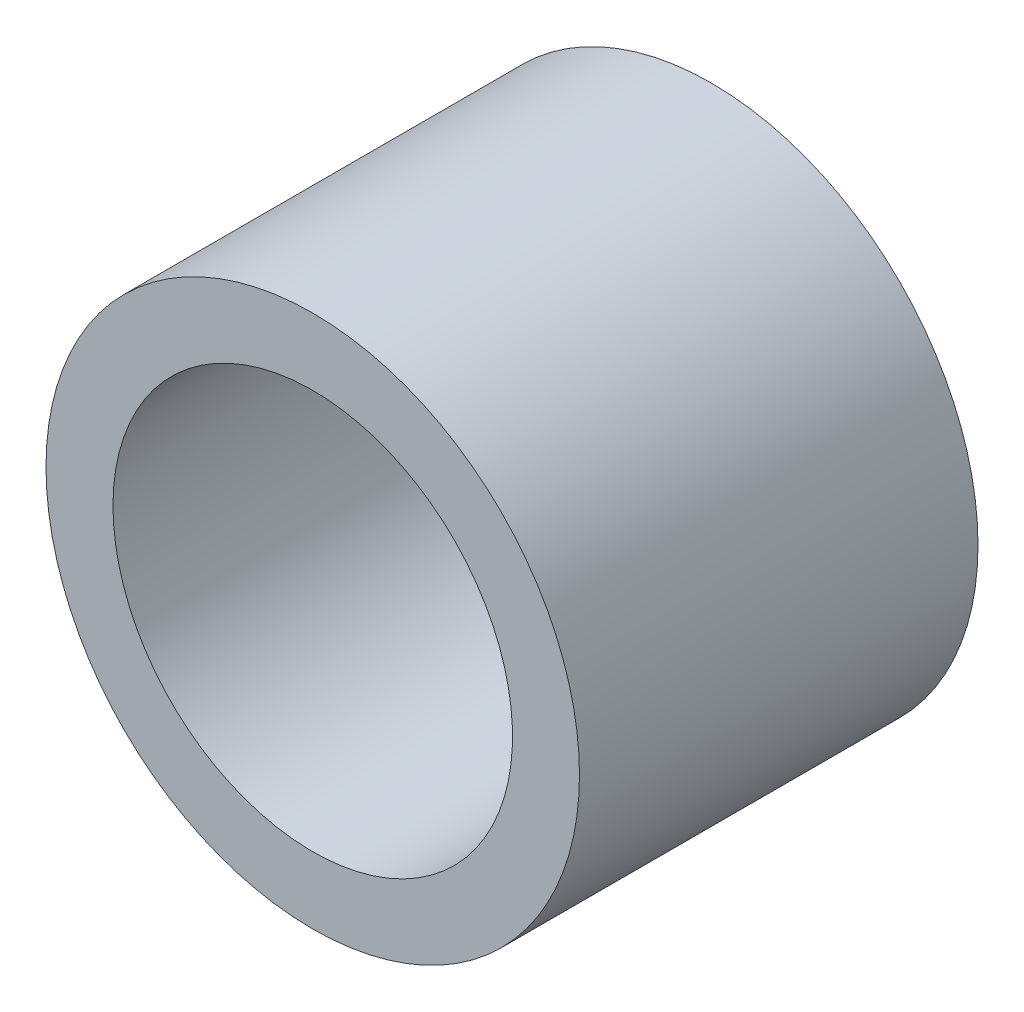
from build123d import *

# Parameters (mm, degrees)
SKETCH1_R      = 6.3754
SKETCH1_R_2    = 4.7752
EXTRUDE1_DEPTH = 4.7625


with BuildPart() as part:
    # Sketch1 → Extrude1 (new, symmetric)
    with BuildSketch(Plane.XY):
        with Locations(Location((0, 0, 0), (0, 0, 180))):
            Circle(SKETCH1_R)
        with Locations(Location((0, 0, 0), (0, 0, 180))):
            Circle(SKETCH1_R_2, mode=Mode.SUBTRACT)
    extrude(amount=EXTRUDE1_DEPTH, both=True)


solid = part.part
